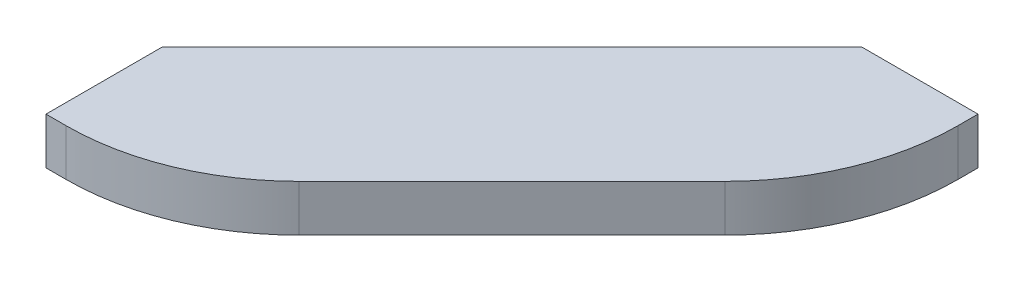
from build123d import *

# Parameters (mm, degrees)
SKETCH1_W           = 50.8
SKETCH1_H           = 50.8
BOSS_EXTRUDE1_DEPTH = 5.08
CUT_EXTRUDE1_DEPTH  = 50.8
FILLET1_R           = 25.4


with BuildPart() as part:
    # Sketch1 → Boss-Extrude1 (new body)
    with BuildSketch(Plane(origin=(0, 0, 0), x_dir=(1, 0, 0), z_dir=(0, 1, 0))):
        Rectangle(SKETCH1_W, SKETCH1_H)
    extrude(amount=BOSS_EXTRUDE1_DEPTH)

    # Sketch6 → Cut-Extrude1 (cut)
    with BuildSketch(Plane(origin=(0, 5.08, 0), x_dir=(1, 0, 0), z_dir=(0, 1, 0))):
        Polygon((-25.4, -12.7), (-25.4, 25.4), (12.7, 25.4), align=None)
        Polygon((25.4, 12.7), (25.4, -25.4), (-12.7, -25.4), align=None)
    extrude(amount=-CUT_EXTRUDE1_DEPTH, mode=Mode.SUBTRACT)

    # Fillet1
    fillet1_edges = [part.edges().sort_by_distance(p)[0] for p in [
        (-12.7, 2.54, 25.4),
        (25.4, 2.54, -12.7),
    ]]
    fillet(fillet1_edges, radius=FILLET1_R)


solid = part.part
